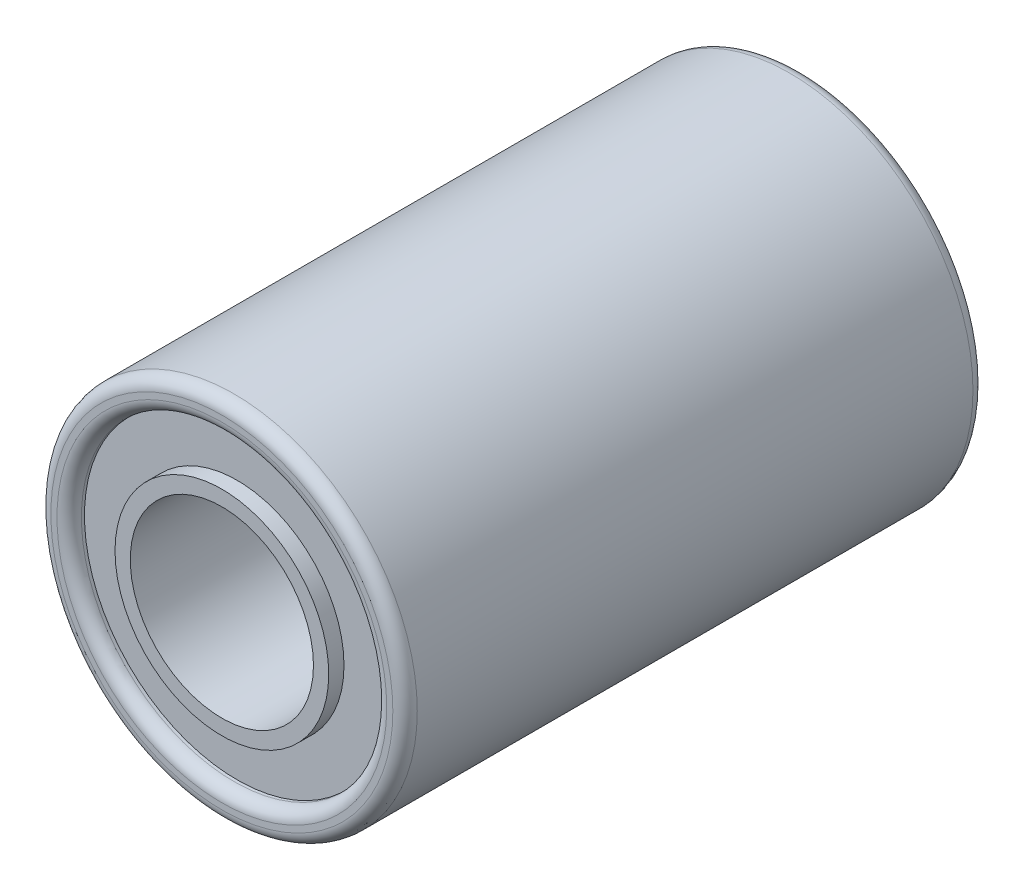
from build123d import *

# Parameters (mm, degrees)
SKETCH_2_R          = 6
SKETCH_2_R_2        = 3
EXTRUDE_1_DEPTH     = 19
SKETCH_3_R          = 5
SKETCH_3_R_2        = 3.5
CUT_EXTRUDE_1_DEPTH = 0.5
CUT_EXTRUDE_START   = -0.5
SKETCH_4_R          = 5
SKETCH_4_R_2        = 3.5
CUT_EXTRUDE_2_DEPTH = 0.5
FILLET_1_R          = 0.4


with BuildPart() as part:
    # 草图2 → 凸台-拉伸1 (new body)
    with BuildSketch(Plane.XY):
        Circle(SKETCH_2_R)
        Circle(SKETCH_2_R_2, mode=Mode.SUBTRACT)
    extrude(amount=EXTRUDE_1_DEPTH)

    # 草图3 → 切除-拉伸1 (cut)
    with BuildSketch(Plane.XY.offset(19)):
        Circle(SKETCH_3_R)
        Circle(SKETCH_3_R_2, mode=Mode.SUBTRACT)
    extrude(amount=-CUT_EXTRUDE_1_DEPTH, mode=Mode.SUBTRACT)

    # 草图4 → 切除-拉伸2 (cut)
    with BuildSketch(Plane(origin=(0, 0, 0), x_dir=(-1, 0, 0), z_dir=(0, 0, -1)).offset(CUT_EXTRUDE_START)):
        with Locations(Location((0, 0, 0), (0, 0, 180))):
            Circle(SKETCH_4_R)
        with Locations(Location((0, 0, 0), (0, 0, 180))):
            Circle(SKETCH_4_R_2, mode=Mode.SUBTRACT)
    extrude(amount=CUT_EXTRUDE_2_DEPTH, mode=Mode.SUBTRACT)

    # 圆角1
    fillet_1_edges = [part.edges().sort_by_distance(p)[0] for p in [
        (-5, 0, 19),
        (-6, 0, 0),
        (-5, 0, 0),
        (-6, 0, 19),
    ]]
    fillet(fillet_1_edges, radius=FILLET_1_R)


solid = part.part
